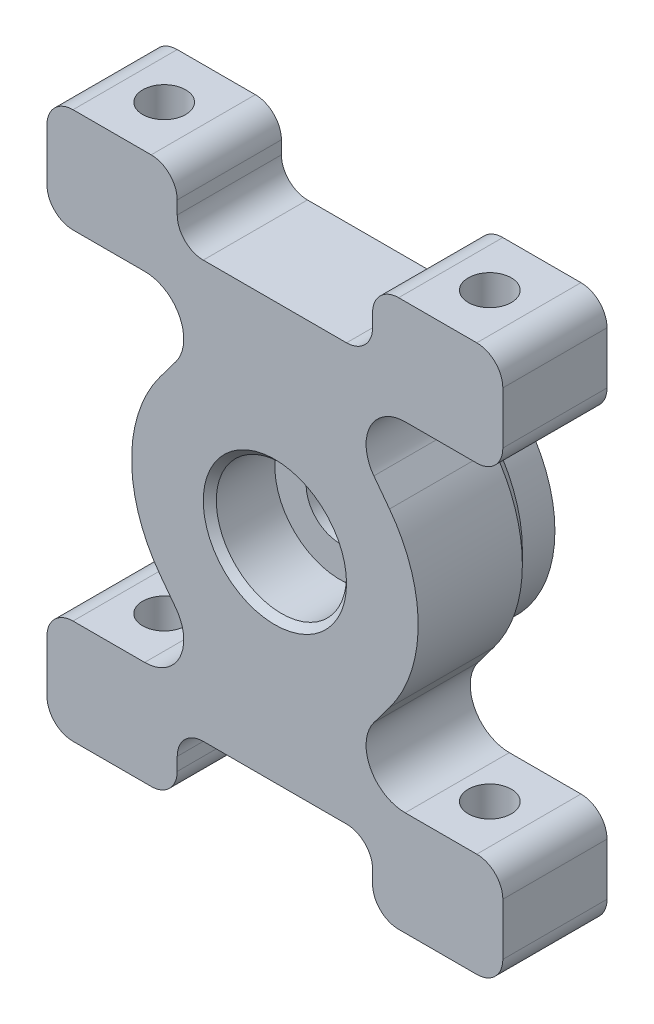
from build123d import *

# Parameters (mm, degrees)
SKETCH_1_W             = 35
SKETCH_1_H             = 42
EXTRUDE_1_DEPTH        = 4
SKETCH_4_R             = 10
EXTRUDE_2_DEPTH        = 3.5
CUT_EXTRUDE_START      = -2
CUT_EXTRUDE_2_DEPTH    = 2
SKETCH_6_R             = 2.6
CUT_EXTRUDE_3_DEPTH    = 30.656365253
SKETCH_7_R             = 5
CUT_EXTRUDE_4_DEPTH    = 5
CHAMFER_1_SIZE         = 0.5
CHAMFER_2_SIZE         = 0.5
CHAMFER_3_SIZE         = 1
CUT_EXTRUDE_5_DEPTH    = 30.656365253
FILLET_1_R             = 3
HOLE_WIZARD_M4_1_D     = 3.3
HOLE_WIZARD_M4_1_DEPTH = 8
SKETCH_14_W            = 15
SKETCH_14_H            = 5
CUT_EXTRUDE_6_DEPTH    = 29.482450737
FILLET_2_R             = 2
FILLET_3_R             = 2


with BuildPart() as part:
    # 草图1 → 凸台-拉伸1 (new, symmetric)
    with BuildSketch(Plane.XY):
        Rectangle(SKETCH_1_W, SKETCH_1_H)
    extrude(amount=EXTRUDE_1_DEPTH, both=True)

    # 草图4 → 凸台-拉伸2 (add)
    with BuildSketch(Plane(origin=(0, 0, -4), x_dir=(-1, 0, 0), z_dir=(0, 0, -1))):
        with Locations(Location((0, 0, 0), (0, 0, 180))):
            Circle(SKETCH_4_R)
        with BuildLine():
            Line((-5, 6), (5, 6))
            ThreePointArc((5, 6), (5.707106781, 5.707106781), (6, 5))
            Line((6, 5), (6, -5))
            ThreePointArc((6, -5), (5.707106781, -5.707106781), (5, -6))
            Line((5, -6), (-5, -6))
            ThreePointArc((-5, -6), (-5.707106781, -5.707106781), (-6, -5))
            Line((-6, -5), (-6, 5))
            ThreePointArc((-6, 5), (-5.707106781, 5.707106781), (-5, 6))
        make_face(mode=Mode.SUBTRACT)
    extrude(amount=EXTRUDE_2_DEPTH)

    # 草图5 → 切除-拉伸2 (cut)
    with BuildSketch(Plane(origin=(0, 0, -4), x_dir=(-1, 0, 0), z_dir=(0, 0, -1)).offset(CUT_EXTRUDE_START)):
        with BuildLine():
            Line((6, -5), (6, 5))
            ThreePointArc((6, 5), (5.707106781, 5.707106781), (5, 6))
            Line((5, 6), (-5, 6))
            ThreePointArc((-5, 6), (-5.707106781, 5.707106781), (-6, 5))
            Line((-6, 5), (-6, -5))
            ThreePointArc((-6, -5), (-5.707106781, -5.707106781), (-5, -6))
            Line((-5, -6), (5, -6))
            ThreePointArc((5, -6), (5.707106781, -5.707106781), (6, -5))
        make_face()
    extrude(amount=CUT_EXTRUDE_2_DEPTH, mode=Mode.SUBTRACT)

    # 草图6 → 切除-拉伸3 (cut, through all)
    with BuildSketch(Plane.XY.offset(4)):
        Circle(SKETCH_6_R)
    extrude(amount=-CUT_EXTRUDE_3_DEPTH, mode=Mode.SUBTRACT)

    # 草图7 → 切除-拉伸4 (cut)
    with BuildSketch(Plane.XY.offset(4)):
        Circle(SKETCH_7_R)
    extrude(amount=-CUT_EXTRUDE_4_DEPTH, mode=Mode.SUBTRACT)

    # 倒角1
    chamfer_1_edges = [part.edges().sort_by_distance(p)[0] for p in [
        (-5.707106781, 5.707106781, -7.5),
        (0, 6, -7.5),
        (5.707106781, 5.707106781, -7.5),
        (6, 0, -7.5),
        (5.707106781, -5.707106781, -7.5),
        (0, -6, -7.5),
        (-5.707106781, -5.707106781, -7.5),
        (-6, 0, -7.5),
    ]]
    chamfer(chamfer_1_edges, length=CHAMFER_1_SIZE)

    # 倒角2
    chamfer_2_edges = [part.edges().sort_by_distance(p)[0] for p in [
        (-5, 0, 4),
    ]]
    chamfer(chamfer_2_edges, length=CHAMFER_2_SIZE)

    # 倒角3
    chamfer_3_edges = [part.edges().sort_by_distance(p)[0] for p in [
        (-10, 0, -4),
    ]]
    chamfer(chamfer_3_edges, length=CHAMFER_3_SIZE)

    # 草图10 → 切除-拉伸5 (cut, through all)
    with BuildSketch(Plane.XY.offset(4)):
        Polygon((11, -13), (17.5, -13), (17.5, 13), (11, 13), (11, 0), align=None)
        with BuildLine():
            ThreePointArc((8.8, 6.6), (10.435516279, 3.478505426), (11, 0))
            Line((11, 0), (11, 13))
            Line((11, 13), (4, 13))
            Line((4, 13), (8.8, 6.6))
        make_face()
        with BuildLine():
            Line((4, -13), (11, -13))
            Line((11, -13), (11, 0))
            ThreePointArc((11, 0), (10.435516279, -3.478505426), (8.8, -6.6))
            Line((8.8, -6.6), (4, -13))
        make_face()
    cut_extrude_5 = extrude(amount=-CUT_EXTRUDE_5_DEPTH, mode=Mode.SUBTRACT)

    # 镜向1: 切除-拉伸5 across plane
    add(cut_extrude_5.mirror(Plane(origin=(0, 0, 0), x_dir=(0, 0, 1), z_dir=(1, 0, 0))), mode=Mode.SUBTRACT)

    # 圆角1
    fillet_1_edges = [part.edges().sort_by_distance(p)[0] for p in [
        (4, 13, 0),
        (4, -13, 0),
        (-4, -13, 0),
        (-4, 13, 0),
    ]]
    fillet(fillet_1_edges, radius=FILLET_1_R)

    # M4 螺纹孔1
    with Locations(Plane(origin=(0, 21, 0), x_dir=(1, 0, 0), z_dir=(0, 1, 0))):
        with Locations((12.5, 0), (-12.5, 0)):
            hole_wizard_m4_1 = Hole(HOLE_WIZARD_M4_1_D / 2, depth=HOLE_WIZARD_M4_1_DEPTH)

    # 镜向2: M4 螺纹孔1 across plane
    add(hole_wizard_m4_1.mirror(Plane.ZX), mode=Mode.SUBTRACT)

    # 草图14 → 切除-拉伸6 (cut, through all)
    with BuildSketch(Plane(origin=(0, 0, -4), x_dir=(-1, 0, 0), z_dir=(0, 0, -1))):
        with Locations((0, 18.5)):
            Rectangle(SKETCH_14_W, SKETCH_14_H)
        with Locations((0, -18.5)):
            Rectangle(SKETCH_14_W, SKETCH_14_H)
    extrude(amount=-CUT_EXTRUDE_6_DEPTH, mode=Mode.SUBTRACT)

    # 圆角2
    fillet_2_edges = [part.edges().sort_by_distance(p)[0] for p in [
        (17.5, 13, 0),
        (17.5, -13, 0),
        (-17.5, 13, 0),
        (-17.5, -13, 0),
        (17.5, -21, 0),
        (-17.5, -21, 0),
        (-17.5, 21, 0),
        (17.5, 21, 0),
    ]]
    fillet(fillet_2_edges, radius=FILLET_2_R)

    # 圆角3
    fillet_3_edges = [part.edges().sort_by_distance(p)[0] for p in [
        (7.5, 16, 0),
        (7.5, 21, 0),
        (-7.5, 21, 0),
        (-7.5, 16, 0),
        (7.5, -16, 0),
        (-7.5, -16, 0),
        (-7.5, -21, 0),
        (7.5, -21, 0),
    ]]
    fillet(fillet_3_edges, radius=FILLET_3_R)


solid = part.part
